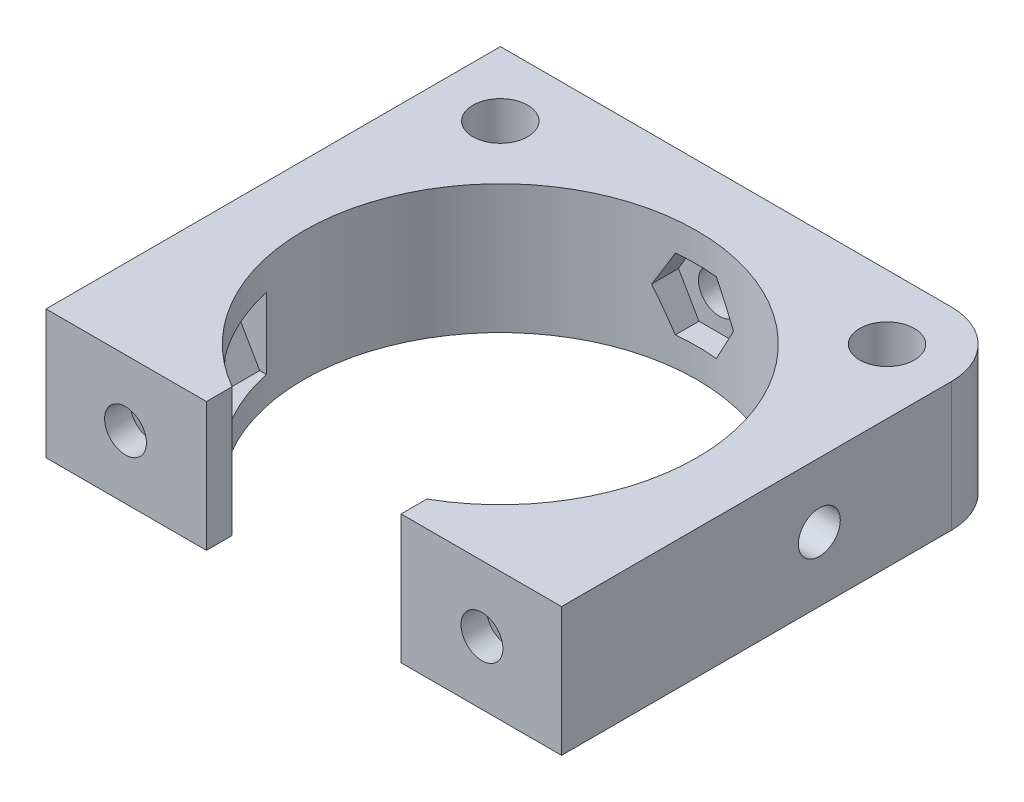
from build123d import *
from build123d.topology import SkipClean

# Parameters (mm, degrees)
CROQUIS1_R                              = 15.25
CROQUIS1_R_2                            = 2.125
SOPORTE_CAJA_REDUCTORA_DEPTH            = 20
CROQUIS3_R                              = 2.125
CORTAR_EXTRUIR1_DEPTH                   = 51.423828692
REDONDEO1_R                             = 5
BOSS_EXTRUDE1_START                     = -20
BOSS_EXTRUDE1_DEPTH                     = 20
CUT_EXTRUDE1_REACH                      = 55.852
SKETCH2_R                               = 1.625
CUT_EXTRUDE2_DEPTH                      = 2
SKETCH4_R                               = 1.625
CUT_EXTRUDE3_DEPTH                      = 63.291652731
CUT_EXTRUDE4_START                      = -4.5
CUT_EXTRUDE4_DEPTH                      = 2
CROQUIS6_W                              = 4.75
CROQUIS6_H                              = 4.75
CORTAR_EXTRUIR17_DEPTH                  = 42.231056256
CROQUIS7_W                              = 60
CROQUIS7_H                              = 20
CORTAR_EXTRUIR18_DEPTH                  = 51.423828692
SALIENTE_EXTRUIR2_DEPTH                 = 49
SOPORTE_START                           = -15
SOPORTE_MOTOR_DEPTH                     = 15
CROQUIS12_R                             = 2.125
AGUJEROS_DE_SUJECION_A_BASE_DEPTH       = 84.087679592
TUERCA_START                            = -4
TUERCA_AGUJERO_DE_SUJECION_A_BASE_DEPTH = 10
SALIENTE_EXTRUIR4_DEPTH                 = 15
CORTAR_EXTRUIR19_DEPTH                  = 25
CROQUIS14_W                             = 50
CROQUIS14_H                             = 118
CORTAR_EXTRUIR22_DEPTH                  = 146.556045907
CROQUIS15_W                             = 10
CROQUIS15_H                             = 7
CORTAR_EXTRUIR23_DEPTH                  = 42.231056256
CORTAR_EXTRUIR24_DEPTH                  = 42.231056256
CROQUIS18_W                             = 40
CROQUIS18_H                             = 10
CORTAR_EXTRUIR25_DEPTH                  = 44.27311521
SALIENTE_EXTRUIR5_DEPTH                 = 10
CROQUIS20_R                             = 1
CORTAR_EXTRUIR26_DEPTH                  = 49.229270158
CORTAR_EXTRUIR27_REACH                  = 62.959
CORTAR_EXTRUIR27_END_RADIUS             = 15.25
CROQUIS21_R                             = 1.625
CROQUIS22_R                             = 2.125
CROQUIS22_R_2                           = 1
SALIENTE_EXTRUIR6_DEPTH                 = 10
CROQUIS23_R                             = 1.625
CORTAR_EXTRUIR28_DEPTH                  = 52.269508521
CORTAR_EXTRUIR29_START                  = -3
CORTAR_EXTRUIR29_DEPTH                  = 10
SALIENTE_EXTRUIR7_DEPTH                 = 10
CORTAR_EXTRUIR30_REACH                  = 72.235
CROQUIS27_R                             = 1.625
CORTAR_EXTRUIR31_REACH                  = 75.235
CORTAR_EXTRUIR31_START                  = -3
CORTAR_EXTRUIR32_REACH                  = 58.612
CROQUIS29_R                             = 1.625
CORTAR_EXTRUIR33_REACH                  = 61.112
CORTAR_EXTRUIR33_START                  = -2.5
CORTAR_EXTRUIR34_DEPTH                  = 63.931555098
CORTAR_EXTRUIR34_DEPTH_BACK             = 63.931555098
CROQUIS35_W                             = 13.305418987
CROQUIS35_H                             = 6.826864192
CORTAR_EXTRUIR35_START                  = -3
CORTAR_EXTRUIR35_DEPTH                  = 10
SALIENTE_EXTRUIR8_DEPTH                 = 10
SALIENTE_EXTRUIR9_DEPTH                 = 13
SALIENTE_EXTRUIR10_DEPTH                = 3
CORTAR_EXTRUIR36_DEPTH                  = 80.887064817
CORTAR_EXTRUIR36_DEPTH_BACK             = 80.887064817
CROQUIS40_W                             = 106.583537839
CROQUIS40_H                             = 47.391515964
CORTAR_EXTRUIR37_DEPTH                  = 67.2524009
CORTAR_EXTRUIR37_DEPTH_BACK             = 67.2524009
CORTAR_EXTRUIR38_DEPTH                  = 79.704784639
CORTAR_EXTRUIR38_DEPTH_BACK             = 79.704784639
SALIENTE_EXTRUIR11_DEPTH                = 10
CORTAR_EXTRUIR39_DEPTH                  = 63.9908649
CROQUIS45_W                             = 31.470301378
CROQUIS45_H                             = 10
CROQUIS45_R                             = 1.625
SALIENTE_EXTRUIR12_DEPTH                = 2.5
SALIENTE_EXTRUIR13_DEPTH                = 10
CORTAR_EXTRUIR40_START                  = -2
CROQUIS47_R                             = 1.625
CORTAR_EXTRUIR40_DEPTH                  = 10
CORTAR_EXTRUIR41_START                  = -12
CROQUIS48_R                             = 1.625
CORTAR_EXTRUIR41_DEPTH                  = 12
CORTAR_EXTRUIR42_DEPTH                  = 3
CORTAR_EXTRUIR43_DEPTH                  = 66.767385996
CORTAR_EXTRUIR43_DEPTH_BACK             = 66.767385996
CROQUIS50_W                             = 80.415439526
CROQUIS50_H                             = 16.145703155
CORTAR_EXTRUIR44_DEPTH                  = 52.795622989
CORTAR_EXTRUIR44_DEPTH_BACK             = 52.795622989
CROQUIS51_R                             = 2.125
CORTAR_EXTRUIR45_DEPTH                  = 52.795622989
CORTAR_EXTRUIR45_DEPTH_BACK             = 52.795622989
SALIENTE_EXTRUIR14_DEPTH                = 10
CORTAR_EXTRUIR46_START                  = -5.5
CORTAR_EXTRUIR46_DEPTH                  = 49.164449388
CORTAR_EXTRUIR47_DEPTH                  = 42.681058385
CORTAR_EXTRUIR47_DEPTH_BACK             = 42.681058385
CROQUIS55_W                             = 24.668528906
CROQUIS55_H                             = 42.621944376


with BuildPart() as part:
    # Croquis1 → Soporte caja reductora (new body)
    with BuildSketch(Plane(origin=(0, 0, 0), x_dir=(1, 0, 0), z_dir=(0, 1, 0))):
        Polygon((-30, -15.25), (-20, -15.25), (-20, -20), (20, -20), (20, -15.25), (30, -15.25), (30, -7.25), (20, -4.25), (20, 20), (-20, 20), (-20, -4.25), (-30, -7.25), align=None)
        with Locations(Location((0, 0, 0), (0, 0, 270))):
            Circle(CROQUIS1_R, mode=Mode.SUBTRACT)
        with Locations(Location((-15, 15, 0), (0, 0, 270))):
            Circle(CROQUIS1_R_2, mode=Mode.SUBTRACT)
        with Locations(Location((15, 15, 0), (0, 0, 270))):
            Circle(CROQUIS1_R_2, mode=Mode.SUBTRACT)
    extrude(amount=-SOPORTE_CAJA_REDUCTORA_DEPTH)

    # Croquis3 → Cortar-Extruir1 (cut, through all)
    with BuildSketch(Plane.XY.offset(15.25)):
        with Locations((-23.5, -10)):
            Circle(CROQUIS3_R)
        with Locations((23.5, -10)):
            Circle(CROQUIS3_R)
    extrude(amount=-CORTAR_EXTRUIR1_DEPTH, mode=Mode.SUBTRACT)

    # Redondeo1
    redondeo1_edges = [part.edges().sort_by_distance(p)[0] for p in [
        (-20, -10, -20),
        (20, -10, -20),
    ]]
    fillet(redondeo1_edges, radius=REDONDEO1_R)

    # Sketch1 → Boss-Extrude1 (add)
    with BuildSketch(Plane(origin=(0, 0, 0), x_dir=(1, 0, 0), z_dir=(0, 1, 0)).offset(BOSS_EXTRUDE1_START)):
        with BuildLine():
            Line((25.5, 15), (20, 15))
            ThreePointArc((20, 15), (18.535533906, 18.535533906), (15, 20))
            Line((15, 20), (30, 20))
            Line((30, 20), (30, 8))
            Line((30, 8), (25.5, 8))
            Line((25.5, 8), (25.5, 15))
        make_face()
    extrude(amount=BOSS_EXTRUDE1_DEPTH)

    # Sketch2 → Cut-Extrude1 (cut, up to next)
    with BuildSketch(Plane(origin=(0, 0, -20), x_dir=(-1, 0, 0), z_dir=(0, 0, -1)), mode=Mode.PRIVATE) as cut_extrude1_sk1:
        with Locations((-22.75, -10)):
            Circle(SKETCH2_R)
    cut_extrude1_tool1 = extrude(cut_extrude1_sk1.sketch, amount=-CUT_EXTRUDE1_REACH, mode=Mode.PRIVATE) & part.part
    add(cut_extrude1_tool1.solids().sort_by_distance((22.75, -10, -20))[0], mode=Mode.SUBTRACT)

    # Sketch3 → Cut-Extrude2 (cut)
    with BuildSketch(Plane.XY.offset(-15)):
        Polygon((20, -11.58771324), (22.75, -13.175426481), (25.5, -11.58771324), (25.5, -8.41228676), (22.75, -6.824573519), (20, -8.41228676), align=None)
    extrude(amount=-CUT_EXTRUDE2_DEPTH, mode=Mode.SUBTRACT)

    # Sketch4 → Cut-Extrude3 (cut, through all)
    with BuildSketch(Plane.ZY.offset(-25.5)):
        with Locations((-12.25, -10)):
            Circle(SKETCH4_R)
    extrude(amount=-CUT_EXTRUDE3_DEPTH, mode=Mode.SUBTRACT)

    # Sketch5 → Cut-Extrude4 (cut)
    with BuildSketch(Plane(origin=(30, 0, 0), x_dir=(0, 0, -1), z_dir=(1, 0, 0)).offset(CUT_EXTRUDE4_START)):
        Polygon((15, -11.58771324), (15, -8.41228676), (12.25, -6.824573519), (9.5, -8.41228676), (9.5, -11.58771324), (12.25, -13.175426481), align=None)
    extrude(amount=CUT_EXTRUDE4_DEPTH, mode=Mode.SUBTRACT)

    # Croquis6 → Cortar-Extruir17 (cut, through all)
    with BuildSketch(Plane(origin=(0, 0, 0), x_dir=(1, 0, 0), z_dir=(0, 1, 0))):
        Polygon((0, -15.25), (-15.25, -15.25), (-15.25, -20), (15.25, -20), (15.25, -15.25), align=None)
        with Locations((-17.625, -17.625)):
            Rectangle(CROQUIS6_W, CROQUIS6_H)
        with BuildLine():
            ThreePointArc((0, -15.25), (-10.783378413, -10.783378413), (-15.25, 0))
            Line((-15.25, 0), (-15.25, -15.25))
            Line((-15.25, -15.25), (0, -15.25))
        make_face()
        with BuildLine():
            Line((15.25, -15.25), (15.25, 0))
            ThreePointArc((15.25, 0), (10.783378413, -10.783378413), (0, -15.25))
            Line((0, -15.25), (15.25, -15.25))
        make_face()
        with Locations((17.625, -17.625)):
            Rectangle(CROQUIS6_W, CROQUIS6_H)
    extrude(amount=-CORTAR_EXTRUIR17_DEPTH, mode=Mode.SUBTRACT)


with BuildPart() as body_2:
    # Simetría1: mirrored copy
    add(part.part.mirror(Plane.ZX))

    # Croquis8 → Saliente-Extruir2 (add)
    with SkipClean():  # the faces are left unmerged after this step: merging them gives an invalid solid
        with BuildSketch(Plane(origin=(0, 20, 0), x_dir=(1, 0, 0), z_dir=(0, 1, 0))):
            with BuildLine():
                Line((-12.664515522, 20), (-11.040489496, 13.939052358))
                Line((-11.040489496, 13.939052358), (-10.315162126, 11.232093763))
                ThreePointArc((-10.315162126, 11.232093763), (0, 15.25), (10.315162126, 11.232093763))
                Line((10.315162126, 11.232093763), (10.817418481, 13.87928066))
                Line((10.817418481, 13.87928066), (11.978715476, 20))
                Line((11.978715476, 20), (-12.664515522, 20))
            make_face()
        extrude(amount=SALIENTE_EXTRUIR2_DEPTH)

    # Croquis9 → Soporte motor (add)
    with SkipClean():  # the faces are left unmerged after this step: merging them gives an invalid solid
        with BuildSketch(Plane(origin=(0, 69, 0), x_dir=(1, 0, 0), z_dir=(0, 1, 0)).offset(SOPORTE_START)):
            with BuildLine():
                Line((-20, 15), (-20, -4.25))
                Line((-20, -4.25), (-30, -7.25))
                Line((-30, -7.25), (-30, -15.25))
                Line((-30, -15.25), (0, -15.25))
                Line((0, -15.25), (0, -14.75))
                ThreePointArc((0, -14.75), (-10.429825023, 10.429825023), (14.75, 0))
                Line((14.75, 0), (20, 0))
                Line((20, 0), (20, 13.936837101))
                Line((20, 13.936837101), (12.664515522, 20))
                Line((12.664515522, 20), (-15, 20))
                ThreePointArc((-15, 20), (-18.535533906, 18.535533906), (-20, 15))
            make_face()
        extrude(amount=-SOPORTE_MOTOR_DEPTH)

    # Croquis12 → Agujeros de sujecion a base (cut, through all)
    with SkipClean():  # the faces are left unmerged after this step: merging them gives an invalid solid
        with BuildSketch(Plane.XY.offset(15.25)):
            with Locations((-23.5, 46.5)):
                Circle(CROQUIS12_R)
        extrude(amount=-AGUJEROS_DE_SUJECION_A_BASE_DEPTH, mode=Mode.SUBTRACT)

    # Croquis13 → Tuerca Agujero de sujecion a base (cut)
    with SkipClean():  # the faces are left unmerged after this step: merging them gives an invalid solid
        with BuildSketch(Plane.XY.offset(15.25).offset(TUERCA_START)):
            Polygon((-20, 44.479274058), (-20, 48.520725942), (-23.5, 50.541451884), (-27, 48.520725942), (-27, 44.479274058), (-23.5, 42.458548116), align=None)
        extrude(amount=-TUERCA_AGUJERO_DE_SUJECION_A_BASE_DEPTH, mode=Mode.SUBTRACT)

    # Croquis10 → Saliente-Extruir4 (add)
    with SkipClean():  # the faces are left unmerged after this step: merging them gives an invalid solid
        with BuildSketch(Plane(origin=(0, 69, 0), x_dir=(1, 0, 0), z_dir=(0, 1, 0))):
            with BuildLine():
                ThreePointArc((10.315162126, 11.232093763), (0, 15.25), (-10.315162126, 11.232093763))
                Line((-10.315162126, 11.232093763), (-10.16850369, 10.684757026))
                ThreePointArc((-10.16850369, 10.684757026), (0, 14.75), (10.16850369, 10.684757026))
                Line((10.16850369, 10.684757026), (10.315162126, 11.232093763))
            make_face()
        extrude(amount=-SALIENTE_EXTRUIR4_DEPTH)

    # Croquis11 → Cortar-Extruir19 (cut)
    with SkipClean():  # the faces are left unmerged after this step: merging them gives an invalid solid
        with BuildSketch(Plane.XZ):
            with BuildLine():
                Line((15.25, 4.25), (20, 4.25))
                Line((20, 4.25), (21.972856468, 4.84185694))
                ThreePointArc((21.972856468, 4.84185694), (19.948931102, 10.40625523), (16.543503257, 15.25))
                Line((16.543503257, 15.25), (15.25, 15.25))
                Line((15.25, 15.25), (15.25, 4.25))
            make_face()
            with BuildLine():
                Line((21.972856468, 4.84185694), (30, 7.25))
                Line((30, 7.25), (30, 15.25))
                Line((30, 15.25), (16.543503257, 15.25))
                ThreePointArc((16.543503257, 15.25), (19.948931102, 10.40625523), (21.972856468, 4.84185694))
            make_face()
            with BuildLine():
                ThreePointArc((20, -15), (18.535533906, -18.535533906), (15, -20))
                Line((15, -20), (30, -20))
                Line((30, -20), (30, -8))
                Line((30, -8), (25.5, -8))
                Line((25.5, -8), (25.5, -15))
                Line((25.5, -15), (20, -15))
            make_face()
        extrude(amount=-CORTAR_EXTRUIR19_DEPTH, mode=Mode.SUBTRACT)

    # Simetría2: body 2 across face


with BuildPart() as part_1:
    add(part.part)

    # Croquis7 → Cortar-Extruir18 (cut, through all)
    with BuildSketch(Plane(origin=(0, 0, -20), x_dir=(-1, 0, 0), z_dir=(0, 0, -1))):
        with Locations((0, -10)):
            Rectangle(CROQUIS7_W, CROQUIS7_H)
    extrude(amount=-CORTAR_EXTRUIR18_DEPTH, mode=Mode.SUBTRACT)


with BuildPart() as body_2_1:
    with SkipClean():  # the faces are left unmerged after this step: merging them gives an invalid solid
        add(body_2.part)
        add(body_2.part.mirror(Plane(origin=(-0.247462117, 69, -16.905803936), x_dir=(0, 0, 1), z_dir=(0, 1, 0))))

    # Croquis14 → Cortar-Extruir22 (cut, through all)
    with BuildSketch(Plane.XY.offset(15.25)):
        with Locations((-5, 79)):
            Rectangle(CROQUIS14_W, CROQUIS14_H)
    extrude(amount=-CORTAR_EXTRUIR22_DEPTH, mode=Mode.SUBTRACT)

    # Croquis15 → Cortar-Extruir23 (cut, through all)
    with BuildSketch(Plane.XZ):
        with Locations((-25, 7.75)):
            Rectangle(CROQUIS15_W, CROQUIS15_H)
    extrude(amount=-CORTAR_EXTRUIR23_DEPTH, mode=Mode.SUBTRACT)

    # Croquis16 → Cortar-Extruir24 (cut, through all)
    with BuildSketch(Plane.XZ):
        Polygon((-30, 15.25), (-15.25, 15.25), (-15.25, 12.75), (-20, 12.75), (-20, 11.25), (-30, 11.25), (-30, 12.75), align=None)
    extrude(amount=-CORTAR_EXTRUIR24_DEPTH, mode=Mode.SUBTRACT)

    # Croquis18 → Cortar-Extruir25 (cut, through all)
    with BuildSketch(Plane(origin=(0, 0, -20), x_dir=(-1, 0, 0), z_dir=(0, 0, -1))):
        with Locations((0, 5)):
            Rectangle(CROQUIS18_W, CROQUIS18_H)
    extrude(amount=-CORTAR_EXTRUIR25_DEPTH, mode=Mode.SUBTRACT)

    # Croquis19 → Saliente-Extruir5 (add)
    with BuildSketch(Plane(origin=(0, 20, 0), x_dir=(1, 0, 0), z_dir=(0, 1, 0))):
        Polygon((-20, -12.75), (-34, -12.75), (-34, -7.75), (-24, -7.75), (-20, -3.75), align=None)
    extrude(amount=-SALIENTE_EXTRUIR5_DEPTH)

    # Croquis20 → Cortar-Extruir26 (cut, through all)
    with BuildSketch(Plane(origin=(0, 0, 7.75), x_dir=(-1, 0, 0), z_dir=(0, 0, -1))):
        with Locations((29, 15)):
            Circle(CROQUIS20_R)
    extrude(amount=-CORTAR_EXTRUIR26_DEPTH, mode=Mode.SUBTRACT)

    # Cortar-Extruir27: up to this cylinder (the profile starts outside it)
    cortar_extruir27_end = Plane(origin=(0, 15, 0), z_dir=(0, -1, 0)) * Cylinder(CORTAR_EXTRUIR27_END_RADIUS, 157.418, mode=Mode.PRIVATE)
    # Croquis21 → Cortar-Extruir27 (cut, up to the surface)
    with BuildSketch(Plane(origin=(20, 0, 0), x_dir=(0, 0, -1), z_dir=(1, 0, 0)), mode=Mode.PRIVATE) as cortar_extruir27_sk1:
        with Locations((4.75, 15)):
            Circle(CROQUIS21_R)
    cortar_extruir27_tool1 = extrude(cortar_extruir27_sk1.sketch, amount=-CORTAR_EXTRUIR27_REACH, mode=Mode.PRIVATE) - cortar_extruir27_end
    add(cortar_extruir27_tool1.solids().sort_by_distance((20, 15, -4.75))[0], mode=Mode.SUBTRACT)

    # Croquis22 → Saliente-Extruir6 (add)
    # profile 1 of 2: a face of its own
    with BuildSketch(Plane.XZ.offset(-10)):
        with Locations((-15, -15)):
            Circle(CROQUIS22_R)
        with Locations(Location((-15, -15, 0), (0, 0, 270))):
            Circle(CROQUIS22_R_2, mode=Mode.SUBTRACT)
    # profile 2 of 2: a face of its own
    with BuildSketch(Plane.XZ.offset(-10)):
        with Locations((15, -15)):
            Circle(CROQUIS22_R)
        with Locations(Location((15, -15, 0), (0, 0, 270))):
            Circle(CROQUIS22_R_2, mode=Mode.SUBTRACT)
    extrude(amount=-SALIENTE_EXTRUIR6_DEPTH)

    # Croquis23 → Cortar-Extruir28 (cut, through all)
    with BuildSketch(Plane(origin=(0, 0, -20), x_dir=(-1, 0, 0), z_dir=(0, 0, -1))):
        with Locations((0, 15)):
            Circle(CROQUIS23_R)
    extrude(amount=-CORTAR_EXTRUIR28_DEPTH, mode=Mode.SUBTRACT)

    # Croquis24 → Cortar-Extruir29 (cut)
    with BuildSketch(Plane(origin=(0, 0, -20), x_dir=(-1, 0, 0), z_dir=(0, 0, -1)).offset(CORTAR_EXTRUIR29_START)):
        Polygon((1.58771324, 12.25), (3.175426481, 15), (1.58771324, 17.75), (-1.58771324, 17.75), (-3.175426481, 15), (-1.58771324, 12.25), align=None)
    extrude(amount=-CORTAR_EXTRUIR29_DEPTH, mode=Mode.SUBTRACT)

    # Croquis26 → Saliente-Extruir7 (add)
    with BuildSketch(Plane.XZ.offset(-10)):
        Polygon((-34, 7.75), (-34, 12.75), (-58.825, 12.75), (-39.160527763, -4.104491148), (-20, -4.104491148), (-20, -0.104491148), (-35.732113118, -0.104491148), (-29, 7.75), align=None)
        Polygon((-34.268209086, 7.75), (-39.594516123, 1.535690951), (-46.844874897, 7.75), align=None, mode=Mode.SUBTRACT)
    extrude(amount=-SALIENTE_EXTRUIR7_DEPTH)

    # Croquis27 → Cortar-Extruir30 (cut, up to next)
    with BuildSketch(Plane.XY.offset(12.75), mode=Mode.PRIVATE) as cortar_extruir30_sk1:
        with Locations((-40.544874897, 15)):
            Circle(CROQUIS27_R)
    cortar_extruir30_tool1 = extrude(cortar_extruir30_sk1.sketch, amount=-CORTAR_EXTRUIR30_REACH, mode=Mode.PRIVATE) & body_2_1.part
    # Croquis27 → Cortar-Extruir30 (cut, up to next)
    with BuildSketch(Plane.XY.offset(12.75), mode=Mode.PRIVATE) as cortar_extruir30_sk2:
        with Locations((-29, 15)):
            Circle(CROQUIS27_R)
    cortar_extruir30_tool2 = extrude(cortar_extruir30_sk2.sketch, amount=-CORTAR_EXTRUIR30_REACH, mode=Mode.PRIVATE) & body_2_1.part
    add(cortar_extruir30_tool1.solids().sort_by_distance((-40.544875, 15, 12.75))[0], mode=Mode.SUBTRACT)
    add(cortar_extruir30_tool2.solids().sort_by_distance((-29, 15, 12.75))[0], mode=Mode.SUBTRACT)

    # Croquis28 → Cortar-Extruir31 (cut, up to next)
    with BuildSketch(Plane.XY.offset(12.75).offset(CORTAR_EXTRUIR31_START), mode=Mode.PRIVATE) as cortar_extruir31_sk1:
        Polygon((-38.957161657, 12.25), (-37.369448416, 15), (-38.957161657, 17.75), (-42.132588137, 17.75), (-43.720301378, 15), (-42.132588137, 12.25), align=None)
    cortar_extruir31_tool1 = extrude(cortar_extruir31_sk1.sketch, amount=-CORTAR_EXTRUIR31_REACH, mode=Mode.PRIVATE) & body_2_1.part
    # Croquis28 → Cortar-Extruir31 (cut, up to next)
    with BuildSketch(Plane.XY.offset(12.75).offset(CORTAR_EXTRUIR31_START), mode=Mode.PRIVATE) as cortar_extruir31_sk2:
        Polygon((-27.41228676, 12.25), (-25.824573519, 15), (-27.41228676, 17.75), (-30.58771324, 17.75), (-32.175426481, 15), (-30.58771324, 12.25), align=None)
    cortar_extruir31_tool2 = extrude(cortar_extruir31_sk2.sketch, amount=-CORTAR_EXTRUIR31_REACH, mode=Mode.PRIVATE) & body_2_1.part
    add(cortar_extruir31_tool1.solids().sort_by_distance((-40.544875, 15, 9.75))[0], mode=Mode.SUBTRACT)
    add(cortar_extruir31_tool2.solids().sort_by_distance((-29, 15, 9.75))[0], mode=Mode.SUBTRACT)

    # Croquis29 → Cortar-Extruir32 (cut, up to next)
    with BuildSketch(Plane(origin=(-18.612848159, 0, -21.715982563), x_dir=(-0.7592713073348843, 0, 0.6507742172658468), z_dir=(-0.6507742172658468, 0, -0.7592713073348843)), mode=Mode.PRIVATE) as cortar_extruir32_sk1:
        with Locations((33.812368097, 15)):
            Circle(CROQUIS29_R)
    cortar_extruir32_tool1 = extrude(cortar_extruir32_sk1.sketch, amount=-CORTAR_EXTRUIR32_REACH, mode=Mode.PRIVATE) & body_2_1.part
    add(cortar_extruir32_tool1.solids().sort_by_distance((-44.285609, 15, 0.288235))[0], mode=Mode.SUBTRACT)

    # Croquis31 → Cortar-Extruir33 (cut, up to next)
    with BuildSketch(Plane(origin=(-18.612848159, 0, -21.715982563), x_dir=(-0.7592713073348843, 0, 0.6507742172658468), z_dir=(-0.6507742172658468, 0, -0.7592713073348843)).offset(CORTAR_EXTRUIR33_START), mode=Mode.PRIVATE) as cortar_extruir33_sk1:
        Polygon((36.562368097, 16.58771324), (33.812368097, 18.175426481), (31.062368097, 16.58771324), (31.062368097, 13.41228676), (33.812368097, 11.824573519), (36.562368097, 13.41228676), align=None)
    cortar_extruir33_tool1 = extrude(cortar_extruir33_sk1.sketch, amount=-CORTAR_EXTRUIR33_REACH, mode=Mode.PRIVATE) & body_2_1.part
    add(cortar_extruir33_tool1.solids().sort_by_distance((-42.658674, 15, 2.186413))[0], mode=Mode.SUBTRACT)

    # Croquis35 → Cortar-Extruir34 (cut, two sides: drawn at the far end of the back side and taken through both)
    with BuildSketch(Plane(origin=(0, 20, 0), x_dir=(1, 0, 0), z_dir=(0, 1, 0)).offset(-CORTAR_EXTRUIR34_DEPTH_BACK)):
        with Locations((17.04227466, -3.413432096)):
            Rectangle(CROQUIS35_W, CROQUIS35_H)
    extrude(amount=CORTAR_EXTRUIR34_DEPTH + CORTAR_EXTRUIR34_DEPTH_BACK, mode=Mode.SUBTRACT)

    # Croquis36 → Cortar-Extruir35 (cut)
    with BuildSketch(Plane(origin=(20, 0, 0), x_dir=(0, 0, -1), z_dir=(1, 0, 0)).offset(CORTAR_EXTRUIR35_START)):
        Polygon((7.5, 16.58771324), (4.75, 18.175426481), (2, 16.58771324), (2, 13.41228676), (4.75, 11.824573519), (7.5, 13.41228676), align=None)
    extrude(amount=-CORTAR_EXTRUIR35_DEPTH, mode=Mode.SUBTRACT)

    # Croquis37 → Saliente-Extruir8 (add)
    with BuildSketch(Plane.XZ.offset(-10)):
        Polygon((-39.160527763, -4.104491148), (-20.614919368, -20), (-15, -20), (-19.558128305, -15.637570403), (-33.014002756, -4.104491148), align=None)
    extrude(amount=-SALIENTE_EXTRUIR8_DEPTH)

    # Croquis38 → Saliente-Extruir9 (add)
    with BuildSketch(Plane.XZ.offset(-10)):
        Polygon((-58.825, 12.75), (-38.825, 12.75), (-38.825, 9.75), (-55.324839942, 9.75), align=None)
    extrude(amount=SALIENTE_EXTRUIR9_DEPTH)

    # Croquis39 → Saliente-Extruir10 (add)
    with BuildSketch(Plane.XZ.offset(-10)):
        Polygon((-38.825, 9.75), (-38.825, 7.75), (-38.825, 5.75), (-50.657959865, 5.75), (-52.991399903, 7.75), (-55.324839942, 9.75), align=None)
    extrude(amount=SALIENTE_EXTRUIR10_DEPTH)

    # Simetría3: body 2 across face


with BuildPart() as body_2_2:
    add(body_2_1.part)
    add(body_2_1.part.mirror(Plane(origin=(-18.003999227, 20, -4.220503046), x_dir=(0, 0, 1), z_dir=(0, 1, 0))))

    # Croquis40 → Cortar-Extruir36 (cut, two sides: drawn at the far end of the back side and taken through both)
    with BuildSketch(Plane(origin=(0, 0, -20), x_dir=(-1, 0, 0), z_dir=(0, 0, -1)).offset(-CORTAR_EXTRUIR36_DEPTH_BACK)):
        with Locations((22.395502026, -3.695757982)):
            Rectangle(CROQUIS40_W, CROQUIS40_H)
    extrude(amount=CORTAR_EXTRUIR36_DEPTH + CORTAR_EXTRUIR36_DEPTH_BACK, mode=Mode.SUBTRACT)

    # Croquis41 → Cortar-Extruir37 (cut, two sides: drawn at the far end of the back side and taken through both)
    with BuildSketch(Plane.XZ.offset(-20).offset(-CORTAR_EXTRUIR37_DEPTH_BACK)):
        Polygon((-19.992980133, -22.302484261), (-20, 3.75), (-24, 7.75), (-56.035110209, 7.75), align=None)
    extrude(amount=CORTAR_EXTRUIR37_DEPTH + CORTAR_EXTRUIR37_DEPTH_BACK, mode=Mode.SUBTRACT)

    # Croquis42 → Cortar-Extruir38 (cut, two sides: drawn at the far end of the back side and taken through both)
    with BuildSketch(Plane(origin=(0, 0, 9.75), x_dir=(-1, 0, 0), z_dir=(0, 0, -1)).offset(-CORTAR_EXTRUIR38_DEPTH_BACK)):
        Polygon((46.720301378, 20), (46.720301378, 30), (38.825, 30), (33.492952769, 43.760628779), (49.525340398, 48.951442806), (67.200390695, 42.512205152), (65.906601328, 20), (51.713995885, 13.864168239), align=None)
    extrude(amount=CORTAR_EXTRUIR38_DEPTH + CORTAR_EXTRUIR38_DEPTH_BACK, mode=Mode.SUBTRACT)

    # Croquis43 → Saliente-Extruir11 (add)
    with BuildSketch(Plane.XZ.offset(-20)):
        Polygon((-19.993600539, -20), (-46.720301378, 7.75), (-43.839252857, 10.524807997), (-17.112552018, -17.225192003), align=None)
    extrude(amount=-SALIENTE_EXTRUIR11_DEPTH)

    # Croquis44 → Cortar-Extruir39 (cut, through all)
    with BuildSketch(Plane(origin=(0, 0, 9.75), x_dir=(-1, 0, 0), z_dir=(0, 0, -1))):
        Polygon((38.957161657, 27.75), (37.369448416, 25), (38.957161657, 22.25), (42.132588137, 22.25), (43.720301378, 25), (42.132588137, 27.75), align=None)
    extrude(amount=CORTAR_EXTRUIR39_DEPTH, mode=Mode.SUBTRACT)

    # Croquis45 → Saliente-Extruir12 (add)
    with BuildSketch(Plane.XY.offset(12.75)):
        with Locations((-30.985150689, 25)):
            Rectangle(CROQUIS45_W, CROQUIS45_H)
        with Locations((-40.544874897, 25)):
            Circle(CROQUIS45_R, mode=Mode.SUBTRACT)
        with Locations((-29, 25)):
            Circle(CROQUIS45_R, mode=Mode.SUBTRACT)
    extrude(amount=SALIENTE_EXTRUIR12_DEPTH)

    # Croquis46 → Saliente-Extruir13 (add)
    with BuildSketch(Plane.XZ.offset(-20)):
        with BuildLine():
            Line((15.25, 0), (20, 0))
            Line((20, 0), (20, 15.25))
            Line((20, 15.25), (7.549834435, 15.25))
            Line((7.549834435, 15.25), (7.549834435, 13.25))
            ThreePointArc((7.549834435, 13.25), (13.185171124, 7.662490615), (15.25, 0))
        make_face()
        with BuildLine():
            Line((-15.25, 0), (-15.25, 15.25))
            Line((-15.25, 15.25), (-7.549834435, 15.25))
            Line((-7.549834435, 15.25), (-7.549834435, 13.25))
            ThreePointArc((-7.549834435, 13.25), (-13.185171124, 7.662490615), (-15.25, 0))
        make_face()
    extrude(amount=-SALIENTE_EXTRUIR13_DEPTH)

    # Croquis47 → Cortar-Extruir40 (cut)
    # profile 1 of 2: a face of its own
    with BuildSketch(Plane.XY.offset(15.25).offset(CORTAR_EXTRUIR40_START)):
        Polygon((15.41228676, 22.352505966), (17, 25.102505966), (15.41228676, 27.852505966), (12.236860279, 27.852505966), (10.649147039, 25.102505966), (12.236860279, 22.352505966), align=None)
        with Locations((13.824573519, 25.102505966)):
            Circle(CROQUIS47_R, mode=Mode.SUBTRACT)
    # profile 2 of 2: a face of its own
    with BuildSketch(Plane.XY.offset(15.25).offset(CORTAR_EXTRUIR40_START)):
        Polygon((-12.236860279, 22.352505966), (-15.41228676, 22.352505966), (-17, 25.102505966), (-15.41228676, 27.852505966), (-12.236860279, 27.852505966), (-10.649147039, 25.102505966), align=None)
        with Locations(Location((-13.824573519, 25.102505966, 0), (0, 0, 131.421584744))):
            Circle(CROQUIS47_R, mode=Mode.SUBTRACT)
    extrude(amount=-CORTAR_EXTRUIR40_DEPTH, mode=Mode.SUBTRACT)

    # Croquis48 → Cortar-Extruir41 (cut)
    with BuildSketch(Plane.XY.offset(15.25).offset(CORTAR_EXTRUIR41_START)):
        with Locations((13.824573519, 25.102505966)):
            Circle(CROQUIS48_R)
        with Locations((-13.824573519, 25.102505966)):
            Circle(CROQUIS48_R)
    extrude(amount=CORTAR_EXTRUIR41_DEPTH, mode=Mode.SUBTRACT)

    # Croquis49 → Cortar-Extruir42 (cut)
    with BuildSketch(Plane(origin=(0, 30, 0), x_dir=(1, 0, 0), z_dir=(0, 1, 0))):
        Polygon((-12.979274058, 11.5), (-10.958548116, 15), (-12.979274058, 18.5), (-17.020725942, 18.5), (-19.041451884, 15), (-17.020725942, 11.5), align=None)
        Polygon((17.020725942, 11.5), (19.041451884, 15), (17.020725942, 18.5), (12.979274058, 18.5), (10.958548116, 15), (12.979274058, 11.5), align=None)
    extrude(amount=-CORTAR_EXTRUIR42_DEPTH, mode=Mode.SUBTRACT)

    # Simetría4: body 2 across plane


with BuildPart() as body_2_3:
    add(body_2_2.part)
    add(body_2_2.part.mirror(Plane(origin=(30.896266894, 20, 12.75), x_dir=(0, 0, 1), z_dir=(0, 1, 0))))

    # Croquis50 → Cortar-Extruir43 (cut, two sides: drawn at the far end of the back side and taken through both)
    with BuildSketch(Plane(origin=(0, 0, -20), x_dir=(-1, 0, 0), z_dir=(0, 0, -1)).offset(-CORTAR_EXTRUIR43_DEPTH_BACK)):
        with Locations((12.268612219, 28.072851577)):
            Rectangle(CROQUIS50_W, CROQUIS50_H)
    extrude(amount=CORTAR_EXTRUIR43_DEPTH + CORTAR_EXTRUIR43_DEPTH_BACK, mode=Mode.SUBTRACT)

    # Croquis51 → Cortar-Extruir44 (cut, two sides: drawn at the far end of the back side and taken through both)
    with BuildSketch(Plane.XZ.offset(-10).offset(-CORTAR_EXTRUIR44_DEPTH_BACK)):
        with Locations(Location((-15, -15, 0), (0, 0, 270))):
            Circle(CROQUIS51_R)
        with Locations(Location((15, -15, 0), (0, 0, 270))):
            Circle(CROQUIS51_R)
    extrude(amount=CORTAR_EXTRUIR44_DEPTH + CORTAR_EXTRUIR44_DEPTH_BACK, mode=Mode.SUBTRACT)

    # Croquis52 → Cortar-Extruir45 (cut, two sides: drawn at the far end of the back side and taken through both)
    with BuildSketch(Plane.XZ.offset(-10).offset(-CORTAR_EXTRUIR45_DEPTH_BACK)):
        Polygon((-35.175426481, 15.25), (-35.175426481, 7.75), (-19.995154673, -14.232221634), (-19.993600539, -20), (-54.542897094, 5.516026969), (-50.455586096, 20.949060485), align=None)
    extrude(amount=CORTAR_EXTRUIR45_DEPTH + CORTAR_EXTRUIR45_DEPTH_BACK, mode=Mode.SUBTRACT)

    # Croquis53 → Saliente-Extruir14 (add)
    with BuildSketch(Plane.XZ.offset(-10)):
        Polygon((-35.175426481, 7.75), (-19.993600539, -20), (-20, 3.75), (-24, 7.75), align=None)
    extrude(amount=-SALIENTE_EXTRUIR14_DEPTH)

    # Croquis54 → Cortar-Extruir46 (cut, through all)
    with BuildSketch(Plane.XY.offset(15.25).offset(CORTAR_EXTRUIR46_START)):
        Polygon((-27.41228676, 17.75), (-30.58771324, 17.75), (-32.175426481, 15), (-30.58771324, 12.25), (-27.41228676, 12.25), (-25.824573519, 15), align=None)
    extrude(amount=-CORTAR_EXTRUIR46_DEPTH, mode=Mode.SUBTRACT)

    # Croquis55 → Cortar-Extruir47 (cut, two sides: drawn at the far end of the back side and taken through both)
    with BuildSketch(Plane(origin=(0, 20, 0), x_dir=(1, 0, 0), z_dir=(0, 1, 0)).offset(-CORTAR_EXTRUIR47_DEPTH_BACK)):
        with Locations((-32.327864992, -1.310972188)):
            Rectangle(CROQUIS55_W, CROQUIS55_H)
    extrude(amount=CORTAR_EXTRUIR47_DEPTH + CORTAR_EXTRUIR47_DEPTH_BACK, mode=Mode.SUBTRACT)


solid = body_2_3.part
